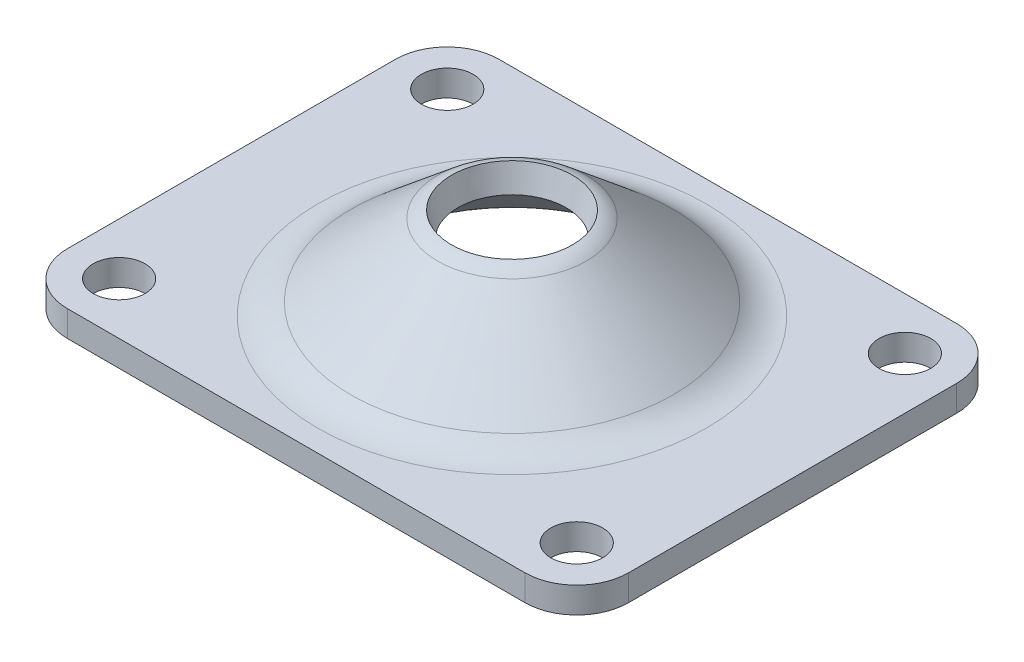
from build123d import *

# Parameters (mm, degrees)
SKETCH1_R           = 3
SKETCH1_R_2         = 22.5
BOSS_EXTRUDE1_DEPTH = 3


with BuildPart() as part:
    # Sketch1 → Boss-Extrude1 (new body)
    with BuildSketch(Plane(origin=(0, 0, 0), x_dir=(1, 0, 0), z_dir=(0, 1, 0))):
        with BuildLine():
            Line((-26.5, 25), (26.5, 25))
            ThreePointArc((26.5, 25), (30.742640687, 23.242640687), (32.5, 19))
            Line((32.5, 19), (32.5, -19))
            ThreePointArc((32.5, -19), (30.742640687, -23.242640687), (26.5, -25))
            Line((26.5, -25), (-26.5, -25))
            ThreePointArc((-26.5, -25), (-30.742640687, -23.242640687), (-32.5, -19))
            Line((-32.5, -19), (-32.5, 19))
            ThreePointArc((-32.5, 19), (-30.742640687, 23.242640687), (-26.5, 25))
        make_face()
        with Locations(Location((-26.5, 19, 0), (0, 0, 270))):
            Circle(SKETCH1_R, mode=Mode.SUBTRACT)
        with Locations(Location((26.5, 19, 0), (0, 0, 270))):
            Circle(SKETCH1_R, mode=Mode.SUBTRACT)
        with Locations(Location((26.5, -19, 0), (0, 0, 270))):
            Circle(SKETCH1_R, mode=Mode.SUBTRACT)
        with Locations(Location((-26.5, -19, 0), (0, 0, 270))):
            Circle(SKETCH1_R, mode=Mode.SUBTRACT)
        with Locations(Location((0, 0, 0), (0, 0, 270))):
            Circle(SKETCH1_R_2, mode=Mode.SUBTRACT)
    extrude(amount=BOSS_EXTRUDE1_DEPTH)

    # Sketch2 → Revolve3 (revolve)
    with BuildSketch(Plane.XY, mode=Mode.PRIVATE) as revolve3_sk:
        with BuildLine():
            Line((-18.643274342, 4.403733341), (-8.616164915, 12.817477163))
            ThreePointArc((-8.616164915, 12.817477163), (-7.85514437, 13.320291088), (-7, 13.637627215))
            Line((-7, 13.637627215), (-6.283760857, 10.724381347))
            ThreePointArc((-6.283760857, 10.724381347), (-6.49754695, 10.645047315), (-6.687802086, 10.519343834))
            Line((-6.687802086, 10.519343834), (-16.714911513, 2.105600012))
            ThreePointArc((-16.714911513, 2.105600012), (-19.42181871, 0.542766413), (-22.5, 0))
            Line((-22.5, 0), (-22.5, 3))
            ThreePointArc((-22.5, 3), (-20.44787914, 3.361844275), (-18.643274342, 4.403733341))
        make_face()
    revolve(revolve3_sk.sketch.rotate(Axis((0, 0, 0), (0, 1, 0)), 180), axis=Axis((0, 0, 0), (0, 1, 0)))


solid = part.part
